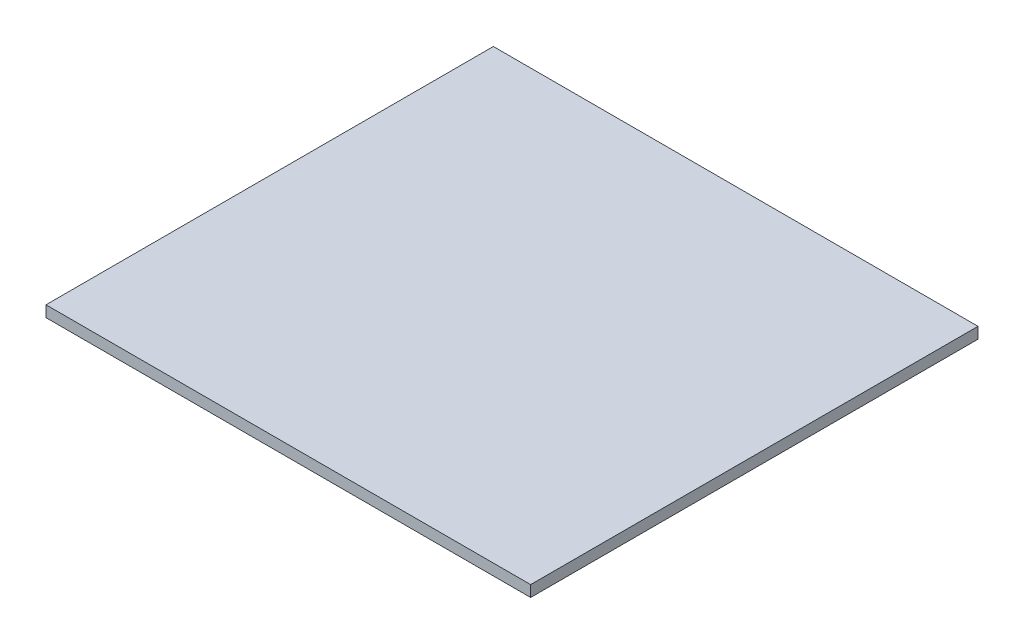
from build123d import *

# Parameters (mm, degrees)
SKETCH_1_W      = 130
SKETCH_1_H      = 120
EXTRUDE_1_DEPTH = 3


with BuildPart() as part:
    # 草圖1 → 伸長1 (new body)
    with BuildSketch(Plane(origin=(0, 0, 0), x_dir=(1, 0, 0), z_dir=(0, 1, 0))):
        with Locations((-65, 60)):
            Rectangle(SKETCH_1_W, SKETCH_1_H)
    extrude(amount=EXTRUDE_1_DEPTH)


solid = part.part
